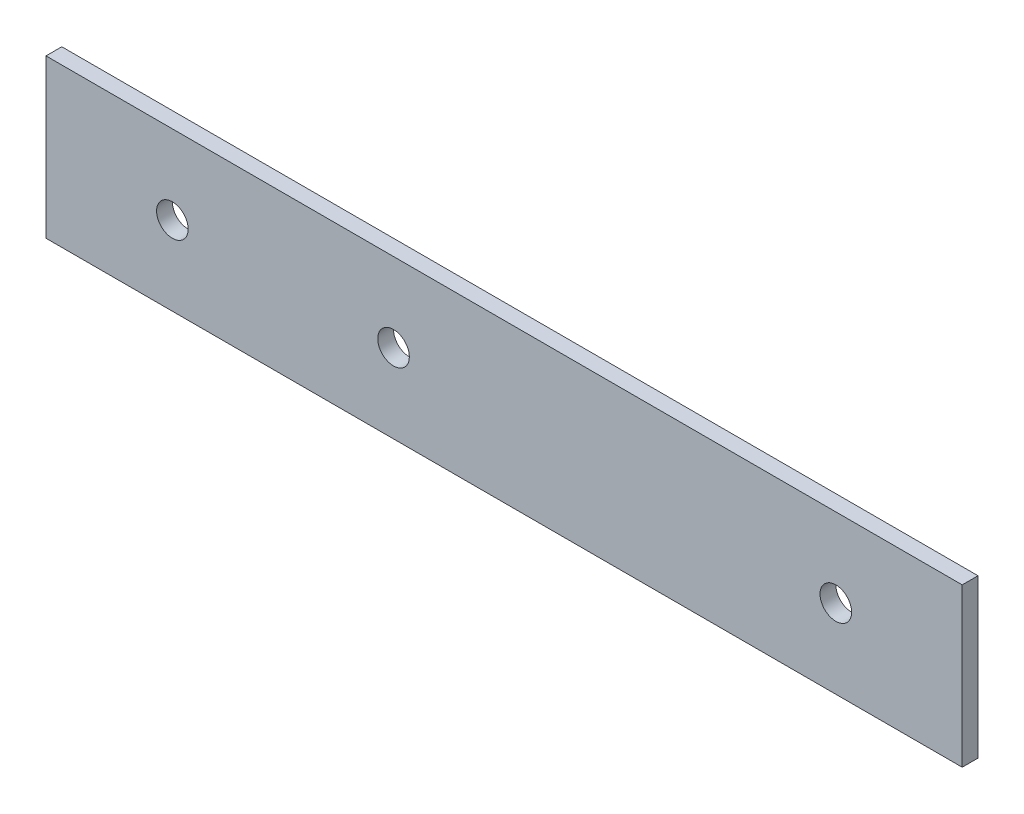
from build123d import *

# Parameters (mm, degrees)
SKETCH1_W           = 290
SKETCH1_H           = 50
SKETCH1_R           = 5
BOSS_EXTRUDE1_DEPTH = 5


with BuildPart() as part:
    # Sketch1 → Boss-Extrude1 (new body)
    with BuildSketch(Plane.XY):
        with Locations((21.323529412, 33.373161765)):
            Rectangle(SKETCH1_W, SKETCH1_H)
        with Locations((126.323529412, 33.373161765)):
            Circle(SKETCH1_R, mode=Mode.SUBTRACT)
        with Locations((-13.676470588, 33.373161765)):
            Circle(SKETCH1_R, mode=Mode.SUBTRACT)
        with Locations((-83.676470588, 33.373161765)):
            Circle(SKETCH1_R, mode=Mode.SUBTRACT)
    extrude(amount=BOSS_EXTRUDE1_DEPTH)


solid = part.part
